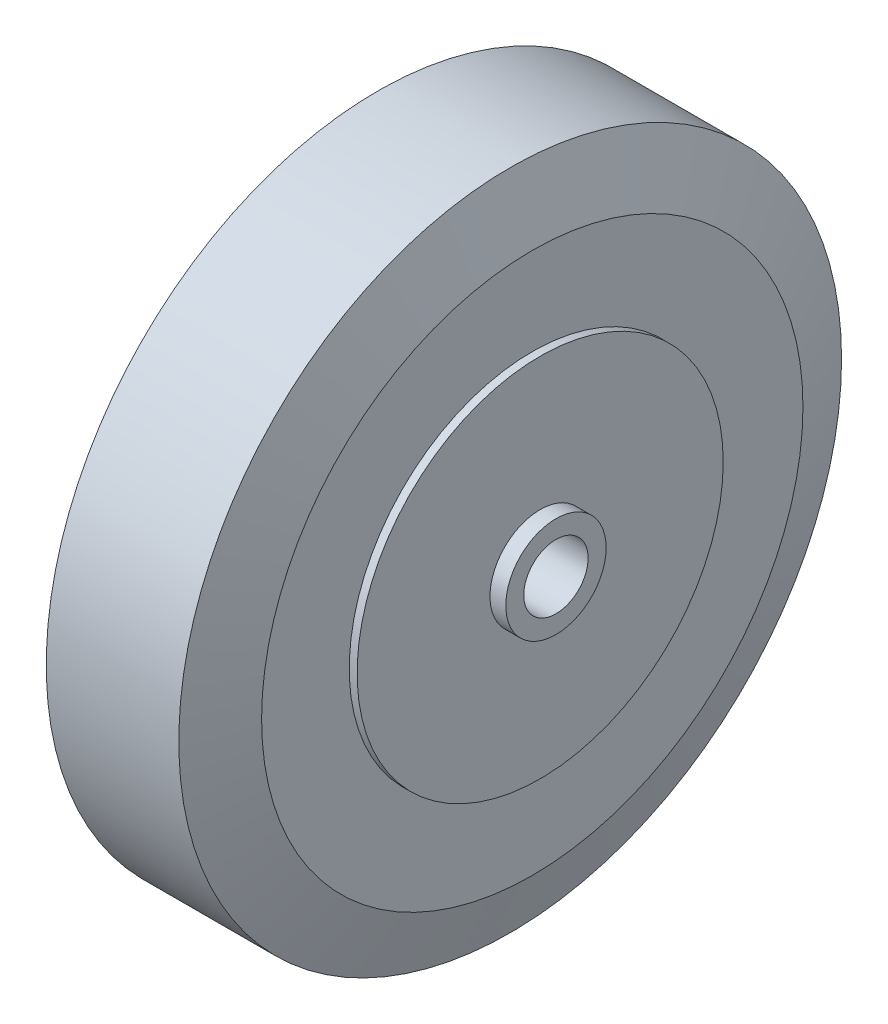
from build123d import *


with BuildPart() as part:
    # Szkic2 → Obrót1 (revolve)
    with BuildSketch(Plane.XY, mode=Mode.PRIVATE) as obr_t1_sk:
        Polygon((0, 10.2), (-35.5, 10.2), (-35.5, 15.9), (-30.5, 15.9), (-30.5, 58), (-28, 58), (-28, 85.767658064), (-21, 105), (0, 105), align=None)
    obr_t1 = revolve(obr_t1_sk.sketch.rotate(Axis((0, 0, 0), (-1, 0, 0)), 90), axis=Axis((0, 0, 0), (-1, 0, 0)))

    # Lustro2: Obrót1 across Right Plane
    add(obr_t1.mirror(Plane(origin=(0, 0, 0), x_dir=(0, 0, -1), z_dir=(1, 0, 0))))


solid = part.part
